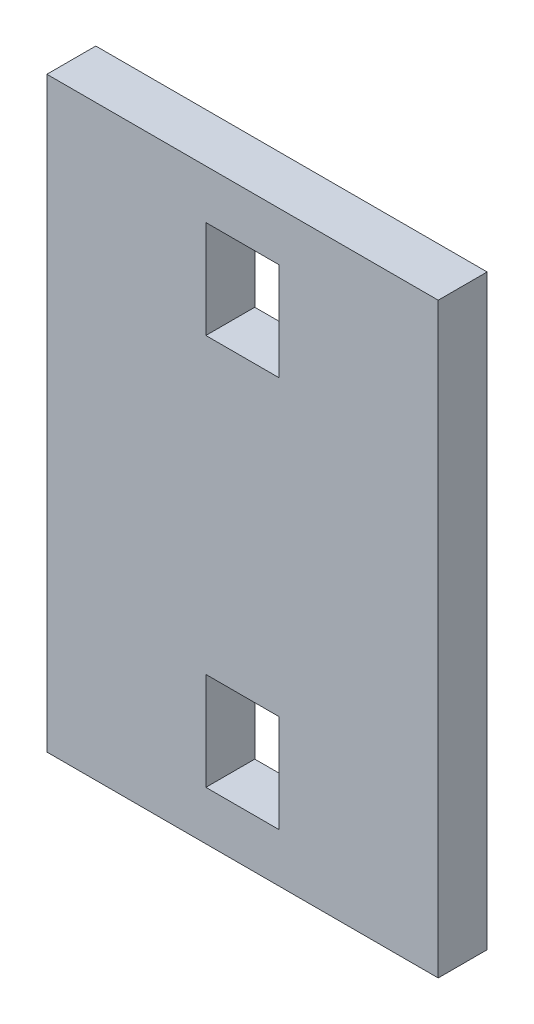
from build123d import *

# Parameters (mm, degrees)
SKETCH1_W           = 76.2
SKETCH1_H           = 50.8
BOSS_EXTRUDE1_DEPTH = 6.35
SKETCH2_W           = 9.525
SKETCH2_H           = 12.7
CUT_EXTRUDE1_DEPTH  = 92.800885072


with BuildPart() as part:
    # Sketch1 → Boss-Extrude1 (new body)
    with BuildSketch(Plane(origin=(0, 0, 0), x_dir=(0, 1, 0), z_dir=(0, 0, 1))):
        with Locations((38.1, 25.4)):
            Rectangle(SKETCH1_W, SKETCH1_H)
    extrude(amount=BOSS_EXTRUDE1_DEPTH)

    # Sketch2 → Cut-Extrude1 (cut, through all)
    with BuildSketch(Plane.XY.offset(6.35)):
        with Locations((-25.4, 12.7)):
            Rectangle(SKETCH2_W, SKETCH2_H)
        with Locations((-25.4, 63.5)):
            Rectangle(SKETCH2_W, SKETCH2_H)
    extrude(amount=-CUT_EXTRUDE1_DEPTH, mode=Mode.SUBTRACT)


solid = part.part
